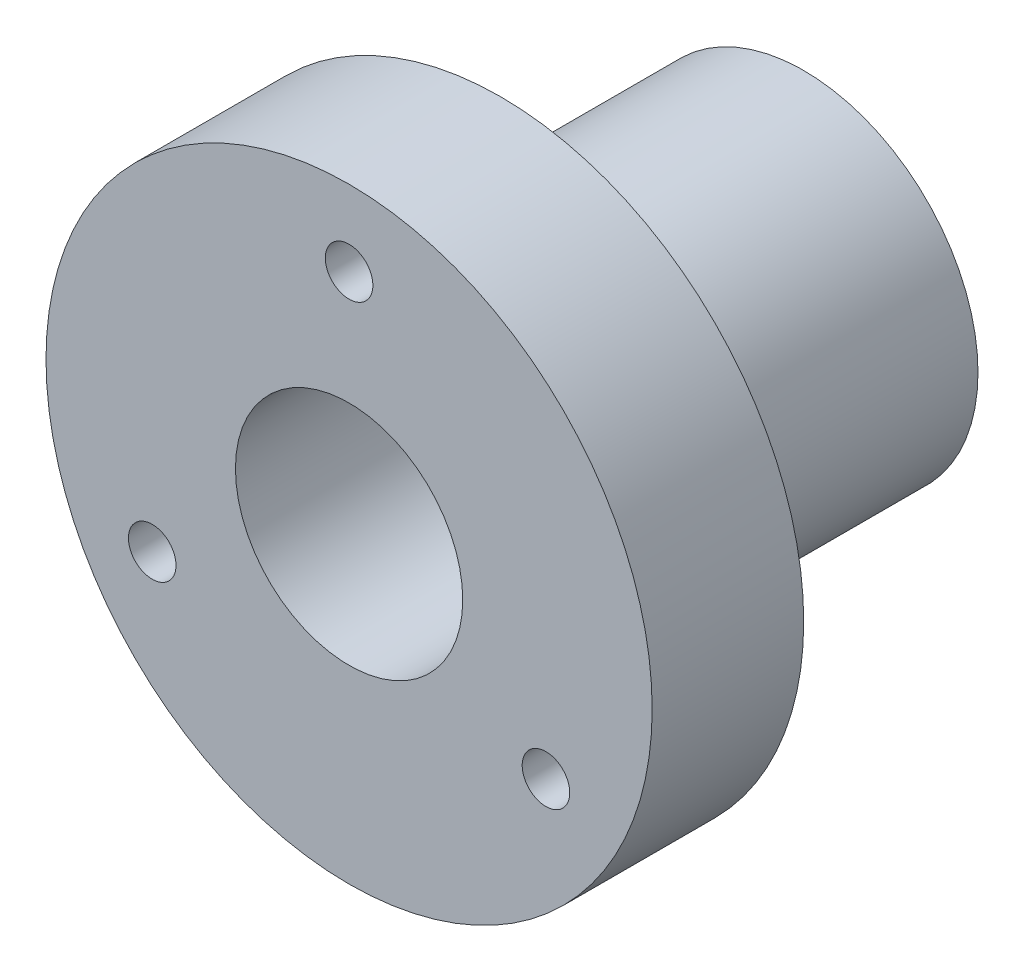
from build123d import *

# Parameters (mm, degrees)
SKETCH1_R                       = 25.4
BOSS_EXTRUDE1_DEPTH             = 12.7
SKETCH9_R                       = 14.605
BOSS_EXTRUDE2_DEPTH             = 38.1
F_10_24_TAPPED_HOLE1_D          = 3.9878
F_8_4_8_4_DIAMETER_HOLE2_D      = 8.4
F_10_0_10_DIAMETER_HOLE1_D      = 10
F_10_0_10_DIAMETER_HOLE1_DEPTH  = 10.16
F_10_0_10_DIAMETER_HOLE1_TIP    = 3.004303095
F_3_4_0_75_DIAMETER_HOLE1_D     = 19.05
F_3_4_0_75_DIAMETER_HOLE1_DEPTH = 22.86
F_3_4_0_75_DIAMETER_HOLE1_TIP   = 5.723197396


with BuildPart() as part:
    # Sketch1 → Boss-Extrude1 (new body)
    with BuildSketch(Plane.XY):
        Circle(SKETCH1_R)
    extrude(amount=-BOSS_EXTRUDE1_DEPTH)

    # Sketch9 → Boss-Extrude2 (add)
    with BuildSketch(Plane.XY):
        Circle(SKETCH9_R)
    extrude(amount=-BOSS_EXTRUDE2_DEPTH)

    # #10-24 Tapped Hole1 (through all)
    with Locations(Plane(origin=(0, 0, -12.7), x_dir=(-1, 0, 0), z_dir=(0, 0, -1))):
        with Locations((0, 19.05), (-16.497783942, -9.525), (16.497783942, -9.525)):
            Hole(F_10_24_TAPPED_HOLE1_D / 2)

    # Ø8.4 (8.4) Diameter Hole2 (through all)
    with Locations(Plane(origin=(0, 0, -38.1), x_dir=(-1, 0, 0), z_dir=(0, 0, -1))):
        with Locations((0, 0)):
            Hole(F_8_4_8_4_DIAMETER_HOLE2_D / 2)

    # Ø10.0 (10) Diameter Hole1
    with Locations(Plane(origin=(0, 0, -38.1), x_dir=(-1, 0, 0), z_dir=(0, 0, -1))):
        with Locations((0, 0)):
            Hole(F_10_0_10_DIAMETER_HOLE1_D / 2, depth=F_10_0_10_DIAMETER_HOLE1_DEPTH)
            with Locations((0, 0, -(F_10_0_10_DIAMETER_HOLE1_DEPTH + F_10_0_10_DIAMETER_HOLE1_TIP / 2))):  # 118° drill point
                Cone(0, F_10_0_10_DIAMETER_HOLE1_D / 2, F_10_0_10_DIAMETER_HOLE1_TIP, mode=Mode.SUBTRACT)

    # 3/4 (0.75) Diameter Hole1
    with Locations(Plane.XY):
        with Locations((0, 0)):
            Hole(F_3_4_0_75_DIAMETER_HOLE1_D / 2, depth=F_3_4_0_75_DIAMETER_HOLE1_DEPTH)
            with Locations((0, 0, -(F_3_4_0_75_DIAMETER_HOLE1_DEPTH + F_3_4_0_75_DIAMETER_HOLE1_TIP / 2))):  # 118° drill point
                Cone(0, F_3_4_0_75_DIAMETER_HOLE1_D / 2, F_3_4_0_75_DIAMETER_HOLE1_TIP, mode=Mode.SUBTRACT)


solid = part.part
